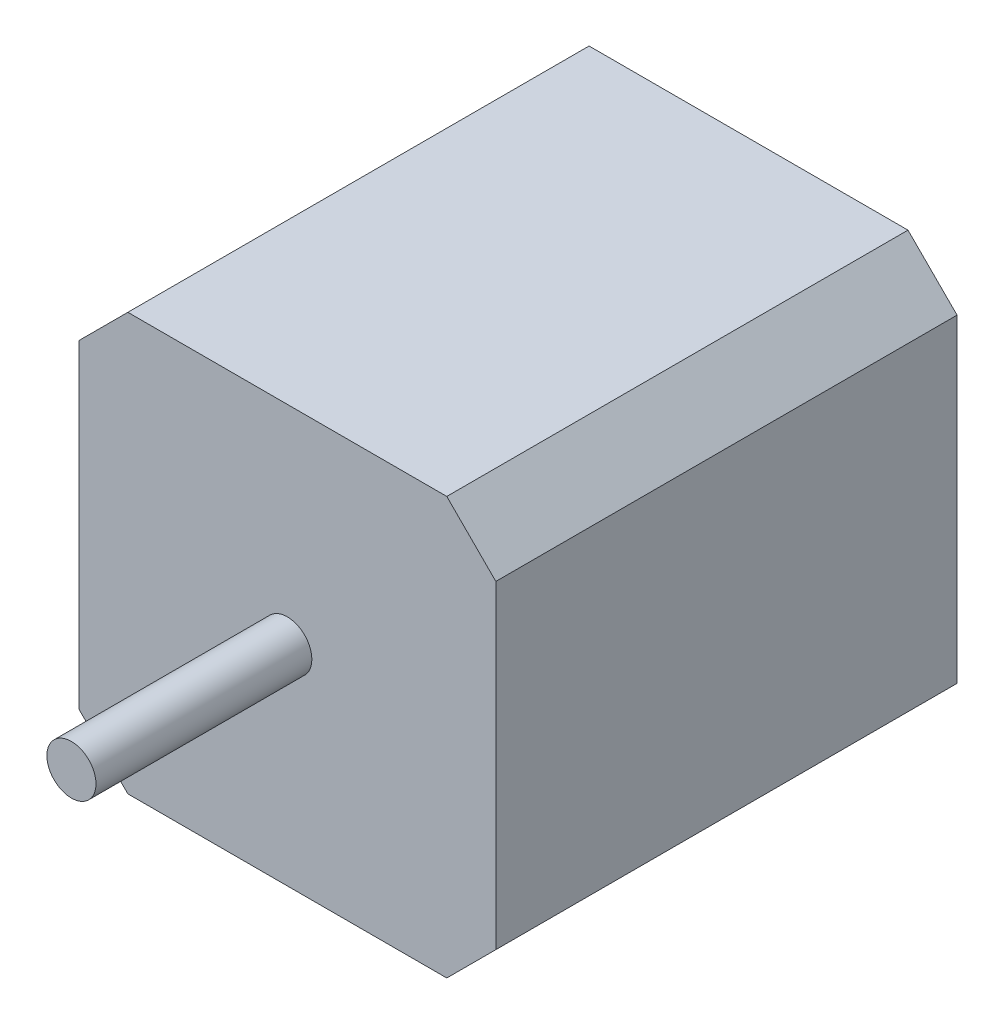
from build123d import *

# Parameters (mm, degrees)
SKETCH1_W           = 42.5
SKETCH1_H           = 42.5
BOSS_EXTRUDE1_DEPTH = 47
CHAMFER1_SIZE       = 5
SKETCH2_R           = 2.5
BOSS_EXTRUDE2_DEPTH = 22


with BuildPart() as part:
    # Sketch1 → Boss-Extrude1 (new body)
    with BuildSketch(Plane.XY):
        with Locations((-20.394847779, 6.347974521)):
            Rectangle(SKETCH1_W, SKETCH1_H)
    extrude(amount=BOSS_EXTRUDE1_DEPTH)

    # Chamfer1
    chamfer1_edges = [part.edges().sort_by_distance(p)[0] for p in [
        (-41.644847779, 27.597974521, 23.5),
        (0.855152221, 27.597974521, 23.5),
        (0.855152221, -14.902025479, 23.5),
        (-41.644847779, -14.902025479, 23.5),
    ]]
    chamfer(chamfer1_edges, length=CHAMFER1_SIZE)

    # Sketch2 → Boss-Extrude2 (add)
    with BuildSketch(Plane.XY.offset(47)):
        with Locations((-20.394847779, 6.347974521)):
            Circle(SKETCH2_R)
    extrude(amount=BOSS_EXTRUDE2_DEPTH)


solid = part.part
